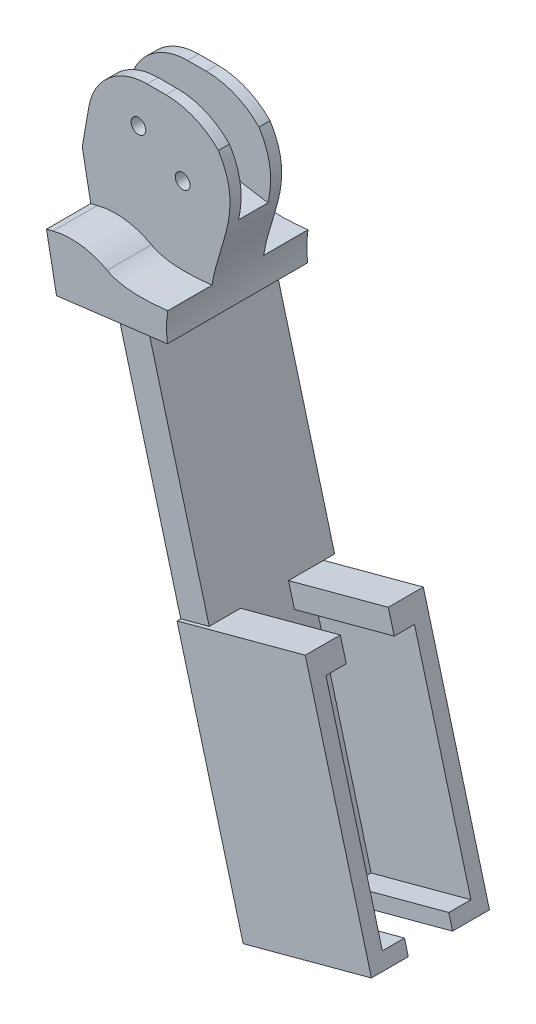
from build123d import *

# Parameters (mm, degrees)
SKETCH10_R                = 1
BOSS_EXTRUDE5_DEPTH       = 7.5
CUT_EXTRUDE1_DEPTH        = 4
FILLET1_R                 = 10
CUT_EXTRUDE6_START        = -11
CUT_EXTRUDE6_DEPTH        = 10
CUT_EXTRUDE7_DEPTH        = 2
BOSS_EXTRUDE11_DEPTH      = 9
BOSS_EXTRUDE13_DEPTH      = 64
BOSS_EXTRUDE13_DEPTH_BACK = 3
SKETCH30_W                = 2
SKETCH30_H                = 15
BOSS_EXTRUDE14_DEPTH      = 14
BOSS_EXTRUDE14_DEPTH_BACK = 4
SKETCH31_W                = 1.5
SKETCH31_H                = 29.5
SKETCH31_W_2              = 0.5
SKETCH31_H_2              = 3.0862264
CUT_EXTRUDE9_DEPTH        = 9
FILLET2_R                 = 8
FILLET3_R                 = 10
BOSS_EXTRUDE15_DEPTH      = 2
BOSS_EXTRUDE16_START      = 2
BOSS_EXTRUDE16_DEPTH      = 2
CUT_EXTRUDE10_DEPTH       = 28


with BuildPart() as part:
    # Sketch10 → Boss-Extrude5 (new, symmetric)
    with BuildSketch(Plane.XY):
        Polygon((27.048887868, 48.656944563), (33.959433176, 37.989988632), (36.993816658, 26.682834617), (12.788755024, 23.658848526), (10.279677841, 36.875809012), (12.321789019, 48.656944563), align=None)
        with Locations((17.890076876, 43.12952492)):
            Circle(SKETCH10_R, mode=Mode.SUBTRACT)
        with Locations((23.882298789, 39.668364252)):
            Circle(SKETCH10_R, mode=Mode.SUBTRACT)
    extrude(amount=BOSS_EXTRUDE5_DEPTH, both=True)

    # Sketch11 → Cut-Extrude1 (cut)
    with BuildSketch(Plane.XY.offset(7.5)):
        with BuildLine():
            Line((17.825431655, 32.423947427), (9.123881611, 30.207909529))
            Line((9.123881611, 30.207909529), (6.594316119, 53.15991455))
            Line((6.594316119, 53.15991455), (34.693470887, 60.271659822))
            Line((34.693470887, 60.271659822), (37.752907488, 30.846026516))
            add(Edge.make_bspline(
                [(37.752907488, 30.846026516), (30.679137573, 30.15507536), (19.269012528, 26.734198276), (17.825431655, 32.423947427)],
                knots=[0, 0, 0, 0, 1, 1, 1, 1], degree=3))
        make_face()
    extrude(amount=-CUT_EXTRUDE1_DEPTH, mode=Mode.SUBTRACT)

    # Fillet1
    fillet1_edges = [part.edges().sort_by_distance(p)[0] for p in [
        (27.048887868, 48.656944563, -2),
    ]]
    fillet(fillet1_edges, radius=FILLET1_R)

    # Sketch11<2> → Cut-Extrude6 (cut)
    with BuildSketch(Plane.XY.offset(7.5).offset(CUT_EXTRUDE6_START)):
        with BuildLine():
            Line((17.825431655, 32.423947427), (9.123881611, 30.207909529))
            Line((9.123881611, 30.207909529), (6.594316119, 53.15991455))
            Line((6.594316119, 53.15991455), (34.693470887, 60.271659822))
            Line((34.693470887, 60.271659822), (37.752907488, 30.846026516))
            add(Edge.make_bspline(
                [(37.752907488, 30.846026516), (30.679137573, 30.15507536), (19.269012528, 26.734198276), (17.825431655, 32.423947427)],
                knots=[0, 0, 0, 0, 1, 1, 1, 1], degree=3))
        make_face()
    extrude(amount=-CUT_EXTRUDE6_DEPTH, mode=Mode.SUBTRACT)

    # Sketch16 → Cut-Extrude7 (cut, symmetric)
    with BuildSketch(Plane.XY):
        Polygon((10.074284509, 54.36084815), (34.418624568, 54.36084815), (34.418624568, 36.664364271), (10.074284509, 40.645108775), align=None)
    extrude(amount=CUT_EXTRUDE7_DEPTH, both=True, mode=Mode.SUBTRACT)

    # Sketch26 → Boss-Extrude11 (add)
    with BuildSketch(Plane(origin=(41.188168375, 11.053240949, 0), x_dir=(0, 0, -1), z_dir=(0.9658266565657433, 0.2591888683316433, 0))):
        Polygon((2, 27.88983665), (2, 26.535626274), (-2, 26.535626274), (-2, 27.88983665), (-3.5, 27.88983665), (-3.5, 20.267140373), (-7.5, 20.267140373), (-7.5, 16.182607471), (7.5, 16.182607471), (7.5, 20.267140372), (3.5, 20.267140373), (3.5, 27.88983665), align=None)
    extrude(amount=BOSS_EXTRUDE11_DEPTH)

    # Sketch30 → Boss-Extrude13 (add, two sides: drawn at the far end of the back side and taken through both)
    with BuildSketch(Plane(origin=(-4.194351717, 15.629593668, 0), x_dir=(0.9658266565657433, 0.25918886833164334, 0), z_dir=(0.25918886833164334, -0.9658266565657433, 0)).offset(-BOSS_EXTRUDE13_DEPTH_BACK)):
        with Locations((27.645507965, 0)):
            Rectangle(SKETCH30_W, SKETCH30_H)
        with Locations((25.645507965, 0)):
            Rectangle(SKETCH30_W, SKETCH30_H)
    extrude(amount=BOSS_EXTRUDE13_DEPTH + BOSS_EXTRUDE13_DEPTH_BACK)

    # Sketch31 → Boss-Extrude14 (add, two sides: drawn at the far end of the back side and taken through both)
    with BuildSketch(Plane(origin=(27.666595183, 7.424596792, 0), x_dir=(0, 0, -1), z_dir=(0.9658266565657432, 0.2591888683316434, 0)).offset(-BOSS_EXTRUDE14_DEPTH_BACK)):
        with Locations((-6.75, -32.567392529)):
            Rectangle(SKETCH31_W, SKETCH31_H)
        with Locations((-7.75, -32.567392529)):
            Rectangle(SKETCH31_W_2, SKETCH31_H)
        with Locations((6.75, -32.567392529)):
            Rectangle(SKETCH31_W, SKETCH31_H)
        with Locations((7.75, -32.567392529)):
            Rectangle(SKETCH31_W_2, SKETCH31_H)
        Polygon((-3, -47.317392529), (-6, -47.317392529), (-7.5, -47.317392529), (-7.5, -47.817392529), (-3, -47.817392529), align=None)
        Polygon((7.5, -47.817392529), (3, -47.817392529), (3, -49.317392529), (8, -49.317392529), (8, -47.317392529), (7.5, -47.317392529), align=None)
        Polygon((3, -47.317392529), (3, -47.817392529), (7.5, -47.817392529), (7.5, -47.317392529), (6, -47.317392529), align=None)
        Polygon((-7.5, -47.817392529), (-7.5, -47.317392529), (-8, -47.317392529), (-8, -49.317392529), (-3, -49.317392529), (-3, -47.817392529), align=None)
        Polygon((-7.5, -17.817392529), (-6, -17.817392529), (-3.25, -17.817392529), (-3.25, -14.731166129), (-7.5, -14.731166129), align=None)
        Polygon((3.25, -17.817392529), (6, -17.817392529), (7.5, -17.817392529), (7.5, -14.731166129), (3.25, -14.731166129), align=None)
        with Locations((7.75, -16.274279329)):
            Rectangle(SKETCH31_W_2, SKETCH31_H_2)
        with Locations((-7.75, -16.274279329)):
            Rectangle(SKETCH31_W_2, SKETCH31_H_2)
    extrude(amount=BOSS_EXTRUDE14_DEPTH + BOSS_EXTRUDE14_DEPTH_BACK)

    # Sketch32 → Cut-Extrude9 (cut)
    with BuildSketch(Plane(origin=(49.880608284, 13.385940764, 0), x_dir=(0, 0, -1), z_dir=(0.9658266565657431, 0.25918886833164445, 0))):
        Polygon((3.5, 27.88983665), (2, 27.88983665), (2, 26.535626274), (-2, 26.535626274), (-2, 27.88983665), (-3.5, 27.88983665), (-3.5, 20.267140373), (-7.5, 20.267140373), (-7.5, 16.182607471), (7.5, 16.182607471), (7.5, 20.267140372), (3.5, 20.267140373), align=None)
    extrude(amount=-CUT_EXTRUDE9_DEPTH, mode=Mode.SUBTRACT)

    # Fillet2
    fillet2_edges = [part.edges().sort_by_distance(p)[0] for p in [
        (12.321789019, 48.656944563, 2.75),
        (12.321789019, 48.656944563, -2.75),
    ]]
    fillet(fillet2_edges, radius=FILLET2_R)

    # Fillet3
    fillet3_edges = [part.edges().sort_by_distance(p)[0] for p in [
        (17.825431655, 32.423947427, 5.5),
        (17.825431655, 32.423947427, -5.5),
    ]]
    fillet(fillet3_edges, radius=FILLET3_R)

    # Sketch33 → Boss-Extrude15 (add)
    with BuildSketch(Plane(origin=(0, 0, -7.5), x_dir=(-1, 0, 0), z_dir=(0, 0, -1))):
        with BuildLine():
            Line((-11.433819556, 30.796185182), (-12.326379112, 31.023494775))
            ThreePointArc((-12.326379112, 31.023494775), (-16.080268918, 31.249787506), (-19.652288318, 30.073533078))
            add(Edge.make_bspline(
                [(-19.652288318, 30.073533078), (-23.094178016, 28.160579122), (-30.349802092, 29.858629099), (-35.935151197, 30.627785373)],
                knots=[0.191604014, 0.191604014, 0.191604014, 0.191604014, 0.918085752, 0.918085752, 0.918085752, 0.918085752], degree=3))
            Line((-35.935151197, 30.627785373), (-36.993816658, 26.682834617))
            Line((-36.993816658, 26.682834617), (-22.968678464, 24.93064644))
            Line((-22.968678464, 24.93064644), (-31.484749461, -6.803156137))
            Line((-31.484749461, -6.803156137), (-27.621442835, -7.839911611))
            Line((-27.621442835, -7.839911611), (-18.961496124, 24.430021246))
            Line((-18.961496124, 24.430021246), (-12.788755024, 23.658848526))
            Line((-12.788755024, 23.658848526), (-11.433819556, 30.796185182))
        make_face()
    extrude(amount=BOSS_EXTRUDE15_DEPTH)

    # Sketch34 → Boss-Extrude16 (add)
    with BuildSketch(Plane.XY.offset(7.5).offset(BOSS_EXTRUDE16_START)):
        with BuildLine():
            Line((12.326379112, 31.023494775), (11.433819556, 30.796185182))
            Line((11.433819556, 30.796185182), (12.788755024, 23.658848526))
            Line((12.788755024, 23.658848526), (22.968678464, 24.93064644))
            Line((22.968678464, 24.93064644), (36.993816658, 26.682834617))
            Line((36.993816658, 26.682834617), (35.935151197, 30.627785373))
            add(Edge.make_bspline(
                [(35.935151197, 30.627785373), (30.349802091, 29.858629099), (23.094178016, 28.160579122), (19.652288318, 30.073533078)],
                knots=[0.191604014, 0.191604014, 0.191604014, 0.191604014, 0.918085752, 0.918085752, 0.918085752, 0.918085752], degree=3))
            ThreePointArc((19.652288318, 30.073533078), (16.080268918, 31.249787506), (12.326379112, 31.023494775))
        make_face()
    extrude(amount=-BOSS_EXTRUDE16_DEPTH)

    # Sketch36 → Cut-Extrude10 (cut)
    with BuildSketch(Plane.XY.offset(9.5)):
        with BuildLine():
            Line((28.735168536, 45.675741107), (43.151621949, 50.021353904))
            Line((43.151621949, 50.021353904), (48.709339966, 19.453904806))
            Line((48.709339966, 19.453904806), (40.633280972, 13.201472036))
            add(Edge.make_bspline(
                [(28.735168536, 45.675741107), (36.204474426, 33.608717883), (15.102513827, 27.616803145), (34.98872361, 13.201472036), (40.633280972, 13.201472036)],
                knots=[0, 0, 0, 0, 0, 1, 1, 1, 1, 1], degree=4))
        make_face()
    extrude(amount=-CUT_EXTRUDE10_DEPTH, mode=Mode.SUBTRACT)


solid = part.part
